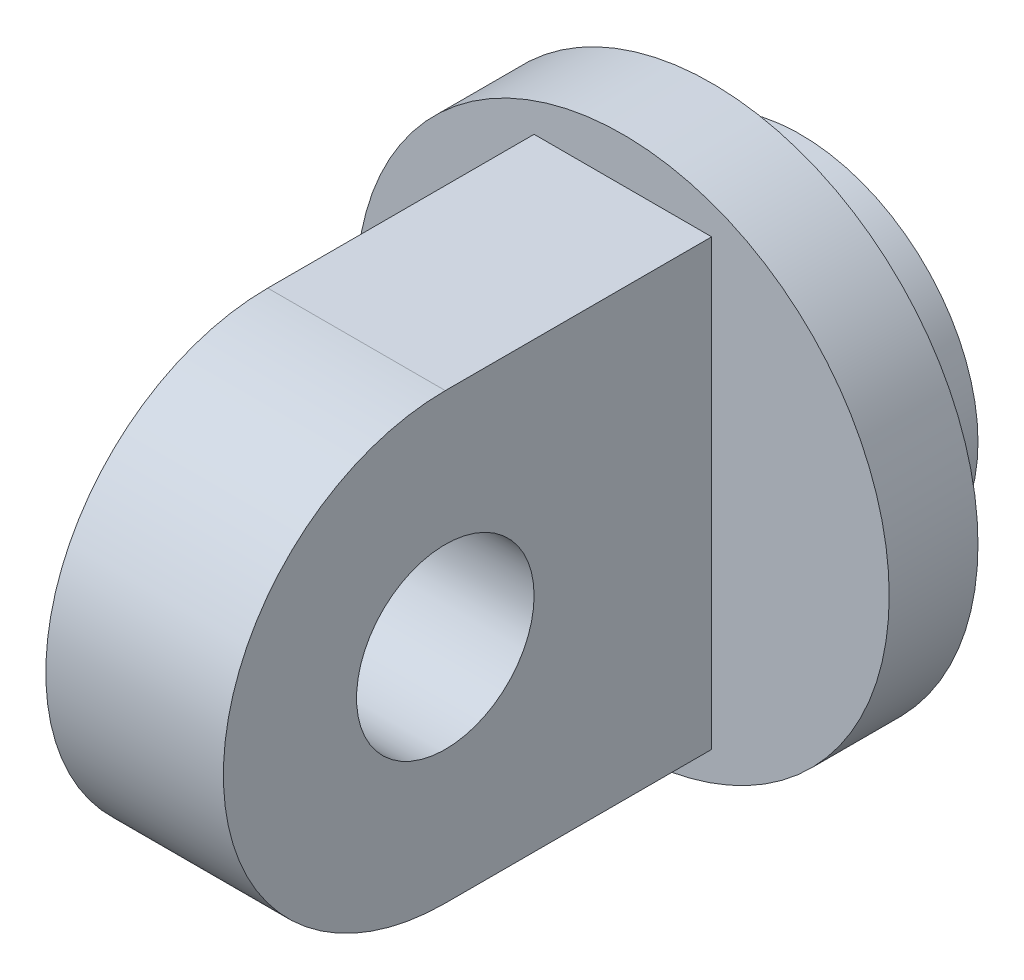
from build123d import *

# Parameters (mm, degrees)
SKETCH1_R           = 500
BOSS_EXTRUDE1_DEPTH = 250
SKETCH3_R           = 125
CUT_EXTRUDE1_DEPTH  = 100
SKETCH4_R           = 750
BOSS_EXTRUDE2_DEPTH = 250
SKETCH5_R           = 250
BOSS_EXTRUDE4_DEPTH = 250


with BuildPart() as part:
    # Sketch1 → Boss-Extrude1 (new body)
    with BuildSketch(Plane.XY):
        Circle(SKETCH1_R)
    extrude(amount=BOSS_EXTRUDE1_DEPTH)

    # Sketch3 → Cut-Extrude1 (cut)
    with BuildSketch(Plane(origin=(0, 0, 0), x_dir=(-1, 0, 0), z_dir=(0, 0, -1))):
        Circle(SKETCH3_R)
    extrude(amount=-CUT_EXTRUDE1_DEPTH, mode=Mode.SUBTRACT)

    # Sketch4 → Boss-Extrude2 (add)
    with BuildSketch(Plane.XY.offset(250)):
        Circle(SKETCH4_R)
    extrude(amount=BOSS_EXTRUDE2_DEPTH)

    # Sketch5 → Boss-Extrude4 (add, symmetric)
    with BuildSketch(Plane(origin=(0, 0, 0), x_dir=(0, 0, -1), z_dir=(1, 0, 0))):
        with BuildLine():
            Line((-1250, 625), (-500, 625))
            Line((-500, 625), (-500, -625))
            Line((-500, -625), (-1250, -625))
            ThreePointArc((-1250, -625), (-1875, 0), (-1250, 625))
        make_face()
        with Locations((-1250, 0)):
            Circle(SKETCH5_R, mode=Mode.SUBTRACT)
    extrude(amount=BOSS_EXTRUDE4_DEPTH, both=True)


solid = part.part
